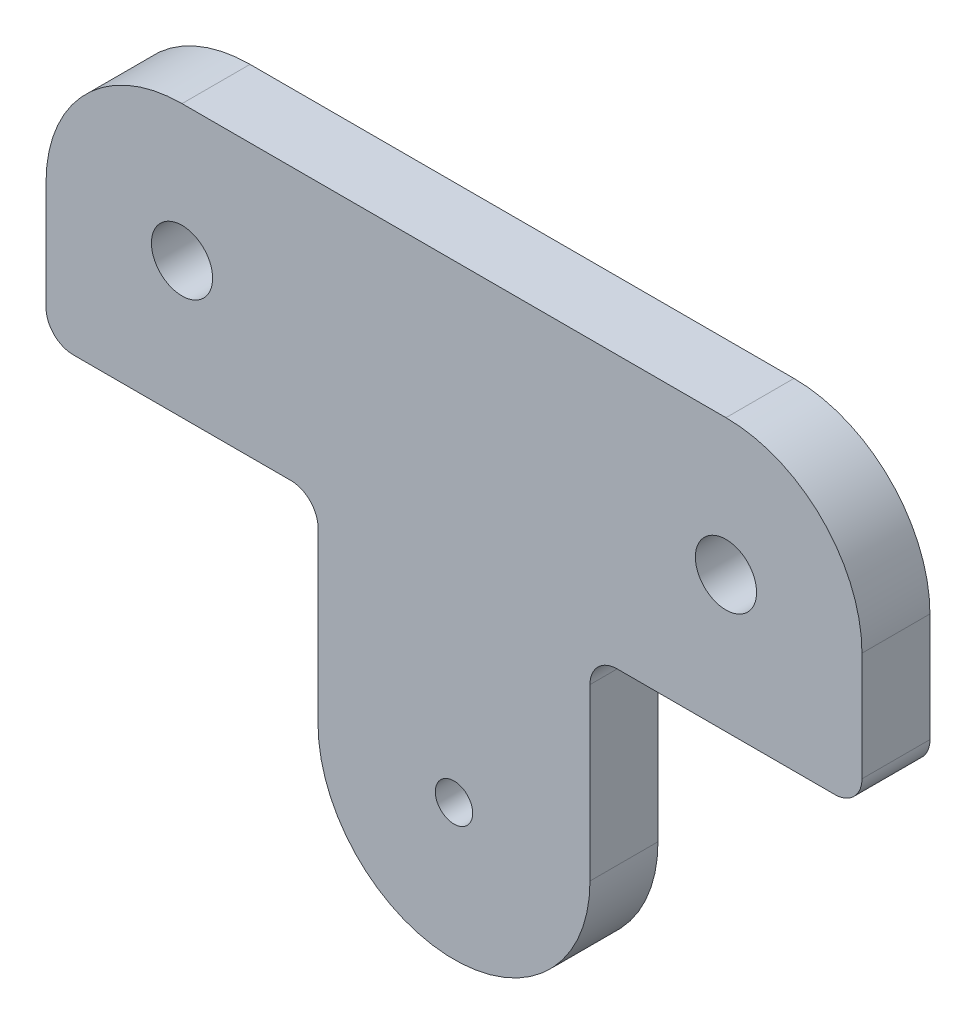
from build123d import *

# Parameters (mm, degrees)
SKETCH1_R           = 1.143
SKETCH1_R_2         = 0.6985
BOSS_EXTRUDE1_DEPTH = 2.54


with BuildPart() as part:
    # Sketch1 → Boss-Extrude1 (new body)
    with BuildSketch(Plane.XY):
        with BuildLine():
            Line((-2.544193385, 2.54), (-2.544193385, -1.524))
            ThreePointArc((-2.544193385, -1.524), (-2.246613875, -2.24242049), (-1.528193385, -2.54))
            Line((-1.528193385, -2.54), (6.599806615, -2.54))
            ThreePointArc((6.599806615, -2.54), (7.318227104, -2.83757951), (7.615806615, -3.556))
            Line((7.615806615, -3.556), (7.615806615, -9.91))
            ThreePointArc((7.615806615, -9.91), (12.695806615, -14.99), (17.775806615, -9.91))
            Line((17.775806615, -9.91), (17.775806615, -3.556))
            ThreePointArc((17.775806615, -3.556), (18.073386125, -2.83757951), (18.791806615, -2.54))
            Line((18.791806615, -2.54), (26.919806615, -2.54))
            ThreePointArc((26.919806615, -2.54), (27.638227104, -2.24242049), (27.935806615, -1.524))
            Line((27.935806615, -1.524), (27.935806615, 2.54))
            ThreePointArc((27.935806615, 2.54), (26.447909063, 6.132102448), (22.855806615, 7.62))
            Line((22.855806615, 7.62), (2.535806615, 7.62))
            ThreePointArc((2.535806615, 7.62), (-1.056295834, 6.132102448), (-2.544193385, 2.54))
        make_face()
        with Locations(Location((2.535806615, 2.54, 0), (0, 0, 180))):
            Circle(SKETCH1_R, mode=Mode.SUBTRACT)
        with Locations(Location((12.695806615, -9.91, 0), (0, 0, 180))):
            Circle(SKETCH1_R_2, mode=Mode.SUBTRACT)
        with Locations(Location((22.855806615, 2.54, 0), (0, 0, 180))):
            Circle(SKETCH1_R, mode=Mode.SUBTRACT)
    extrude(amount=BOSS_EXTRUDE1_DEPTH)


solid = part.part
